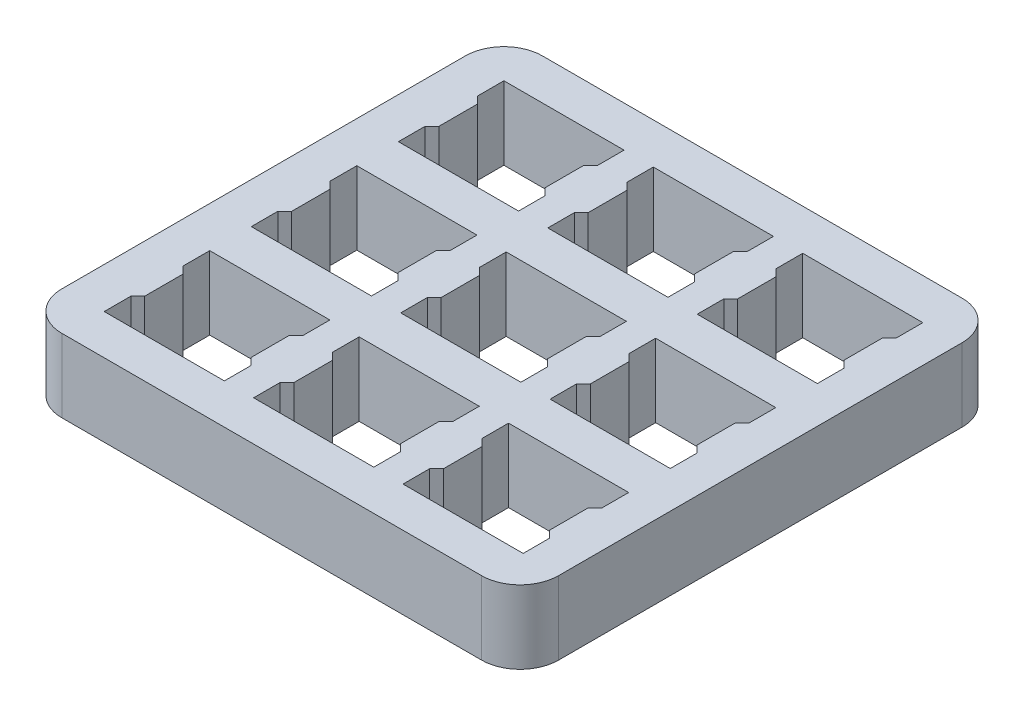
from build123d import *

# Parameters (mm, degrees)
ESQUISSE1_W             = 64.5
ESQUISSE1_H             = 62.4
BOSS_EXTRU_1_DEPTH      = 9.5
ENL_V_MAT_EXTRU_1_DEPTH = 46.866681807
CONG_1_R                = 5


with BuildPart() as part:
    # Esquisse1 → Boss.-Extru.1 (new body)
    with BuildSketch(Plane(origin=(0, 0, 0), x_dir=(1, 0, 0), z_dir=(0, 1, 0))):
        Rectangle(ESQUISSE1_W, ESQUISSE1_H)
    extrude(amount=BOSS_EXTRU_1_DEPTH)

    # Esquisse2 → Enlèv. mat.-Extru.1 (cut, through all)
    with BuildSketch(Plane(origin=(0, 9.5, 0), x_dir=(1, 0, 0), z_dir=(0, 1, 0))):
        Polygon((-26.95, 25.9), (-11.35, 25.9), (-11.35, 22.45), (-12.25, 21.55), (-12.25, 16.55), (-11.35, 15.65), (-11.35, 12.2), (-26.95, 12.2), (-26.95, 15.65), (-26.05, 16.55), (-26.05, 21.55), (-26.95, 22.45), align=None)
        Polygon((-7.55, 25.9), (8.05, 25.9), (8.05, 22.45), (7.15, 21.55), (7.15, 16.55), (8.05, 15.65), (8.05, 12.2), (-7.55, 12.2), (-7.55, 15.65), (-6.65, 16.55), (-6.65, 21.55), (-7.55, 22.45), align=None)
        Polygon((11.85, 25.9), (27.45, 25.9), (27.45, 22.45), (26.55, 21.55), (26.55, 16.55), (27.45, 15.65), (27.45, 12.2), (11.85, 12.2), (11.85, 15.65), (12.75, 16.55), (12.75, 21.55), (11.85, 22.45), align=None)
        Polygon((-7.55, 6.8), (8.05, 6.8), (8.05, 3.35), (7.15, 2.45), (7.15, -2.55), (8.05, -3.45), (8.05, -6.9), (-7.55, -6.9), (-7.55, -3.45), (-6.65, -2.55), (-6.65, 2.45), (-7.55, 3.35), align=None)
        Polygon((11.85, 6.8), (27.45, 6.8), (27.45, 3.35), (26.55, 2.45), (26.55, -2.55), (27.45, -3.45), (27.45, -6.9), (11.85, -6.9), (11.85, -3.45), (12.75, -2.55), (12.75, 2.45), (11.85, 3.35), align=None)
        Polygon((-7.55, -12.3), (8.05, -12.3), (8.05, -15.75), (7.15, -16.65), (7.15, -21.65), (8.05, -22.55), (8.05, -26), (-7.55, -26), (-7.55, -22.55), (-6.65, -21.65), (-6.65, -16.65), (-7.55, -15.75), align=None)
        Polygon((11.85, -12.3), (27.45, -12.3), (27.45, -15.75), (26.55, -16.65), (26.55, -21.65), (27.45, -22.55), (27.45, -26), (11.85, -26), (11.85, -22.55), (12.75, -21.65), (12.75, -16.65), (11.85, -15.75), align=None)
        Polygon((-26.95, 6.8), (-11.35, 6.8), (-11.35, 3.35), (-12.25, 2.45), (-12.25, -2.55), (-11.35, -3.45), (-11.35, -6.9), (-26.95, -6.9), (-26.95, -3.45), (-26.05, -2.55), (-26.05, 2.45), (-26.95, 3.35), align=None)
        Polygon((-26.95, -12.3), (-11.35, -12.3), (-11.35, -15.75), (-12.25, -16.65), (-12.25, -21.65), (-11.35, -22.55), (-11.35, -26), (-26.95, -26), (-26.95, -22.55), (-26.05, -21.65), (-26.05, -16.65), (-26.95, -15.75), align=None)
    extrude(amount=-ENL_V_MAT_EXTRU_1_DEPTH, mode=Mode.SUBTRACT)

    # Congé1
    cong_1_edges = [part.edges().sort_by_distance(p)[0] for p in [
        (32.25, 4.75, 31.2),
        (-32.25, 4.75, 31.2),
        (-32.25, 4.75, -31.2),
        (32.25, 4.75, -31.2),
    ]]
    fillet(cong_1_edges, radius=CONG_1_R)


solid = part.part
